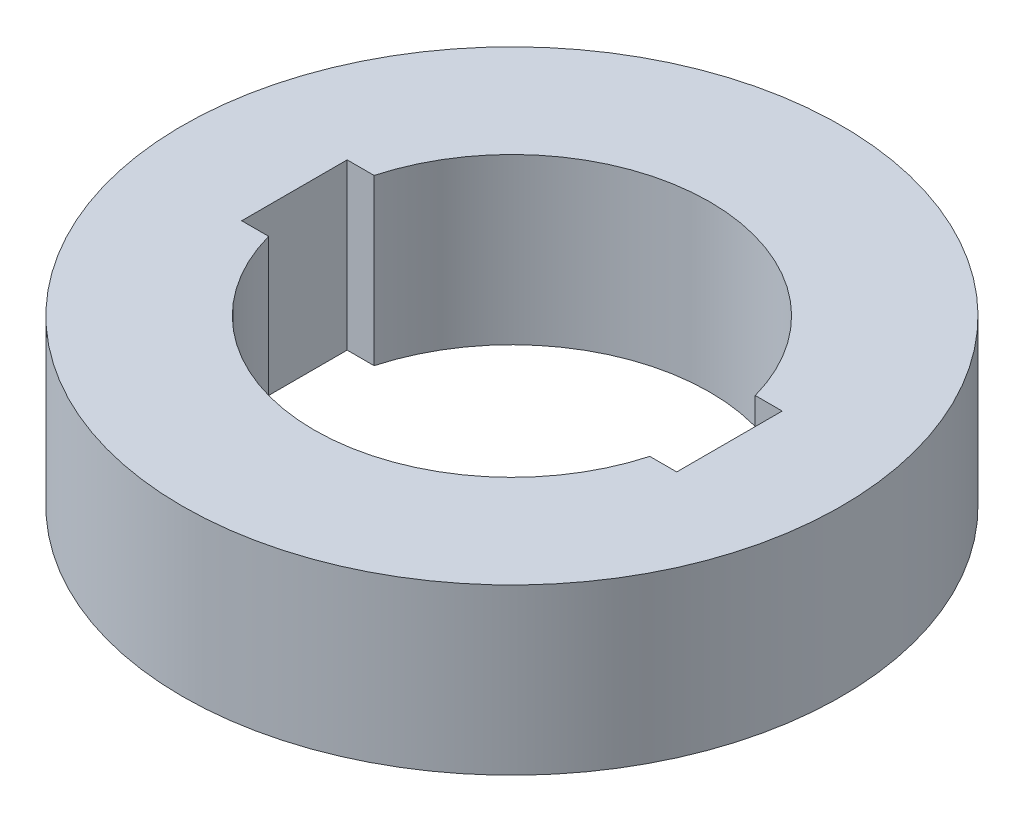
from build123d import *

# Parameters (mm, degrees)
SKETCH1_R           = 50
BOSS_EXTRUDE1_DEPTH = 12.5


with BuildPart() as part:
    # Sketch1 → Boss-Extrude1 (new, symmetric)
    with BuildSketch(Plane(origin=(0, 0, 0), x_dir=(1, 0, 0), z_dir=(0, 1, 0))):
        with Locations(Location((0, 0, 0), (0, 0, 270))):
            Circle(SKETCH1_R)
        with BuildLine():
            Line((-28.91366459, 8), (-33, 8))
            Line((-33, 8), (-33, -8))
            Line((-33, -8), (-28.91366459, -8))
            ThreePointArc((-28.91366459, -8), (0, -30), (28.91366459, -8))
            Line((28.91366459, -8), (33, -8))
            Line((33, -8), (33, 8))
            Line((33, 8), (28.91366459, 8))
            ThreePointArc((28.91366459, 8), (0, 30), (-28.91366459, 8))
        make_face(mode=Mode.SUBTRACT)
    extrude(amount=BOSS_EXTRUDE1_DEPTH, both=True)


solid = part.part
